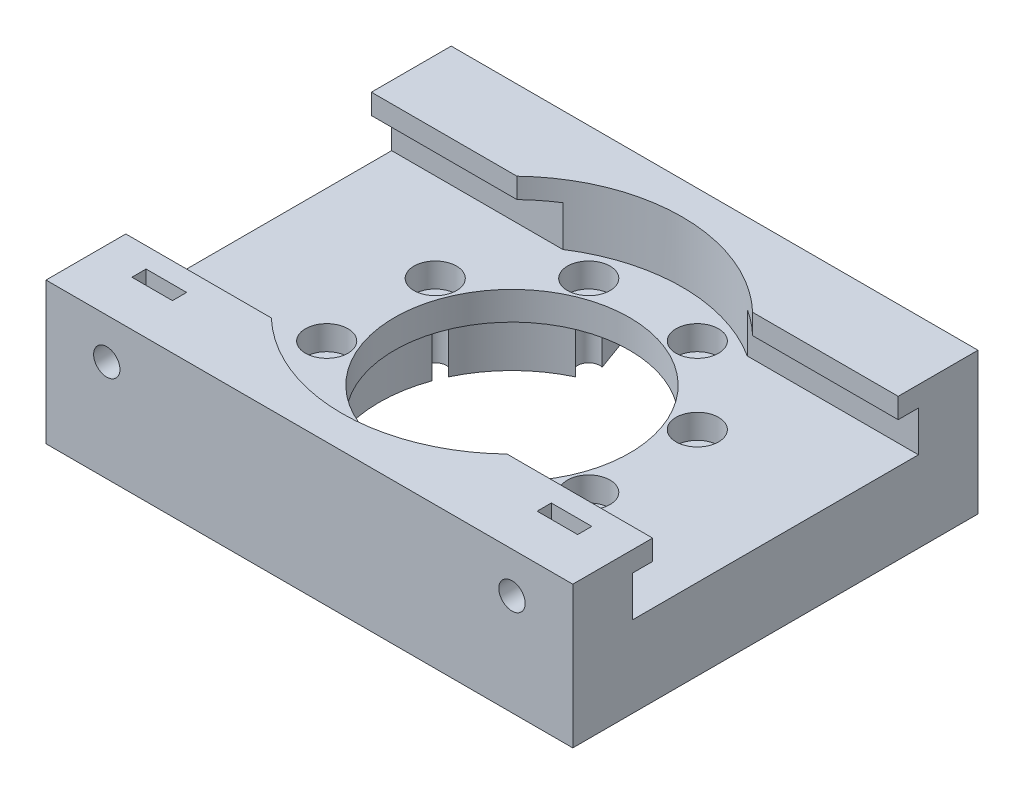
from build123d import *

# Parameters (mm, degrees)
SKETCH1_W                               = 130
SKETCH1_H                               = 100
BOSS_EXTRUDE1_DEPTH                     = 20
CUT_EXTRUDE1_DEPTH                      = 85.409715081
CUT_EXTRUDE1_DEPTH_BACK                 = 85.409715081
SKETCH11_R                              = 29
CBORE_FOR_M5_HEX_HEAD_BOLT2_D           = 5.5
CBORE_FOR_M5_HEX_HEAD_BOLT2_CBORE_D     = 10.5
CBORE_FOR_M5_HEX_HEAD_BOLT2_CBORE_DEPTH = 6
SKETCH15_R                              = 32.75
CUT_EXTRUDE2_DEPTH                      = 13
BOSS_EXTRUDE2_DEPTH                     = 65
BOSS_EXTRUDE2_DEPTH_BACK                = 65
SKETCH17_R                              = 42
CUT_EXTRUDE3_DEPTH                      = 85.409715081
CUT_EXTRUDE4_DEPTH                      = 85.409715081
CUT_EXTRUDE4_DEPTH_BACK                 = 2
SKETCH18_W                              = 10
SKETCH18_H                              = 3.5
SKETCH19_R                              = 3.25
CUT_EXTRUDE5_DEPTH                      = 90.162772501
CUT_EXTRUDE7_DEPTH                      = 11


with BuildPart() as part:
    # Sketch1 → Boss-Extrude1 (new body)
    with BuildSketch(Plane(origin=(0, 0, 0), x_dir=(1, 0, 0), z_dir=(0, 1, 0))):
        Rectangle(SKETCH1_W, SKETCH1_H)
    extrude(amount=BOSS_EXTRUDE1_DEPTH)

    # Sketch11 → Cut-Extrude1 (cut, two sides: drawn at the far end of the back side and taken through both)
    with BuildSketch(Plane(origin=(0, 20, 0), x_dir=(1, 0, 0), z_dir=(0, 1, 0)).offset(-CUT_EXTRUDE1_DEPTH_BACK)):
        with Locations(Location((0, 0, 0), (0, 0, 270))):
            Circle(SKETCH11_R)
    extrude(amount=CUT_EXTRUDE1_DEPTH + CUT_EXTRUDE1_DEPTH_BACK, mode=Mode.SUBTRACT)

    # CBORE for M5 Hex Head Bolt2 (through all)
    with Locations(Plane(origin=(-32.335783638, 20, -13.393920133), x_dir=(0, 0, 1), z_dir=(0, 1, 0))):
        with Locations((0, 0), (-18.941863505, 18.941863505), (-18.941863505, 45.729703771), (0, 64.671567276), (26.787840266, 64.671567276), (45.729703771, 45.729703771), (45.729703771, 18.941863505), (26.787840266, 0)):
            CounterBoreHole(CBORE_FOR_M5_HEX_HEAD_BOLT2_D / 2, CBORE_FOR_M5_HEX_HEAD_BOLT2_CBORE_D / 2, CBORE_FOR_M5_HEX_HEAD_BOLT2_CBORE_DEPTH)

    # Sketch15 → Cut-Extrude2 (cut)
    with BuildSketch(Plane(origin=(0, 0, 0), x_dir=(1, 0, 0), z_dir=(0, 1, 0))):
        Circle(SKETCH15_R)
    extrude(amount=CUT_EXTRUDE2_DEPTH, mode=Mode.SUBTRACT)

    # Sketch16 → Boss-Extrude2 (add, two sides: drawn at the far end of the back side and taken through both)
    with BuildSketch(Plane(origin=(0, 0, 0), x_dir=(0, 0, -1), z_dir=(1, 0, 0)).offset(-BOSS_EXTRUDE2_DEPTH_BACK)):
        Polygon((-50, 20), (-50, 35), (-30.3, 35), (-30.3, 30), (-35.3, 30), (-35.3, 20), align=None)
        Polygon((30.3, 35), (30.3, 30), (35.3, 30), (35.3, 20), (50, 20), (50, 35), align=None)
    extrude(amount=BOSS_EXTRUDE2_DEPTH + BOSS_EXTRUDE2_DEPTH_BACK)

    # Sketch17 → Cut-Extrude3 (cut, through all)
    with BuildSketch(Plane(origin=(0, 20, 0), x_dir=(1, 0, 0), z_dir=(0, 1, 0))):
        Circle(SKETCH17_R)
    extrude(amount=CUT_EXTRUDE3_DEPTH, mode=Mode.SUBTRACT)

    # Sketch18 → Cut-Extrude4 (cut, two sides: drawn at the far end of the back side and taken through both)
    with BuildSketch(Plane(origin=(0, 20, 0), x_dir=(1, 0, 0), z_dir=(0, 1, 0)).offset(-CUT_EXTRUDE4_DEPTH_BACK)):
        with Locations((-50, -37.05)):
            Rectangle(SKETCH18_W, SKETCH18_H)
        with Locations((50, -37.05)):
            Rectangle(SKETCH18_W, SKETCH18_H)
    extrude(amount=CUT_EXTRUDE4_DEPTH + CUT_EXTRUDE4_DEPTH_BACK, mode=Mode.SUBTRACT)

    # Sketch19 → Cut-Extrude5 (cut, through all)
    with BuildSketch(Plane.XY):
        with Locations((-50, 25)):
            Circle(SKETCH19_R)
        with Locations(Location((50, 25, 0), (0, 0, 180))):
            Circle(SKETCH19_R)
    extrude(amount=CUT_EXTRUDE5_DEPTH, mode=Mode.SUBTRACT)

    # Sketch21 → Cut-Extrude7 (cut)
    with BuildSketch(Plane.XZ):
        Polygon((0, 0), (-20.393190362, -56.02983003), (20.393190362, -56.02983003), align=None)
    extrude(amount=-CUT_EXTRUDE7_DEPTH, mode=Mode.SUBTRACT)


solid = part.part
